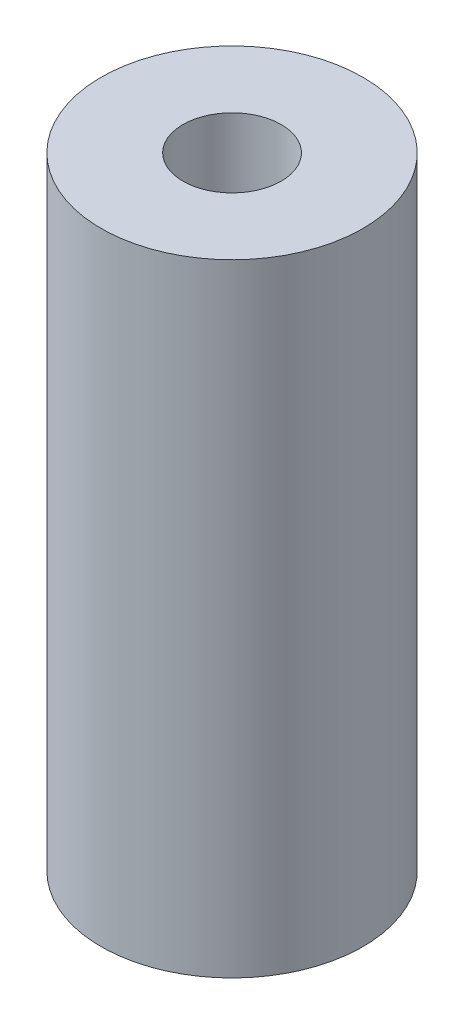
from build123d import *

# Parameters (mm, degrees)
SKETCH1_R           = 25.4
SKETCH1_R_2         = 9.525
BOSS_EXTRUDE1_DEPTH = 120.65


with BuildPart() as part:
    # Sketch1 → Boss-Extrude1 (new body)
    with BuildSketch(Plane(origin=(0, 0, 0), x_dir=(1, 0, 0), z_dir=(0, 1, 0))):
        with Locations(Location((0, 0, 0), (0, 0, 90))):
            Circle(SKETCH1_R)
        with Locations(Location((0, 0, 0), (0, 0, 90))):
            Circle(SKETCH1_R_2, mode=Mode.SUBTRACT)
    extrude(amount=BOSS_EXTRUDE1_DEPTH)


solid = part.part
